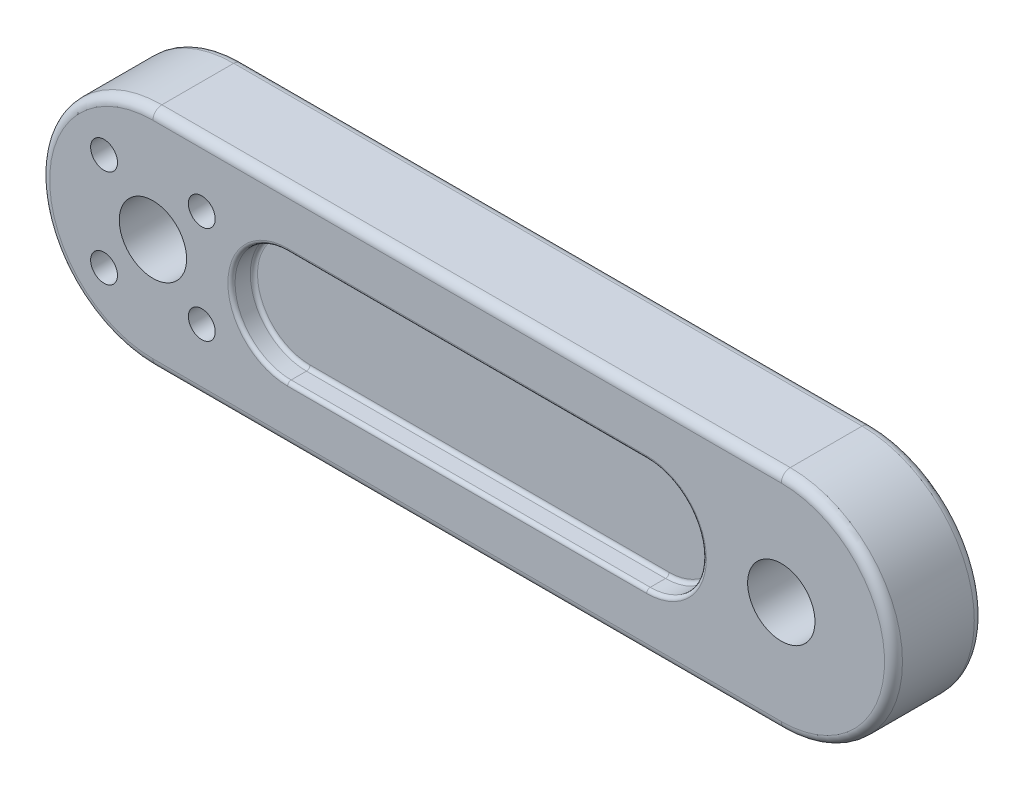
from build123d import *

# Parameters (mm, degrees)
SKETCH1_R           = 4.7625
BOSS_EXTRUDE1_DEPTH = 12.7
CUT_EXTRUDE2_DEPTH  = 12.7
FILLET1_R           = 1.27
CUT_EXTRUDE3_DEPTH  = 3.175
CUT_EXTRUDE4_START  = -3.175
CUT_EXTRUDE4_DEPTH  = 3.175
FILLET2_R           = 0.508


with BuildPart() as part:
    # Sketch1 → Boss-Extrude1 (new body)
    with BuildSketch(Plane.XY):
        with BuildLine():
            Line((-60.265453167, 23.365622701), (28.634546833, 23.365622701))
            ThreePointArc((28.634546833, 23.365622701), (44.509546833, 7.490622701), (28.634546833, -8.384377299))
            Line((28.634546833, -8.384377299), (-60.265453167, -8.384377299))
            ThreePointArc((-60.265453167, -8.384377299), (-76.140453167, 7.490622701), (-60.265453167, 23.365622701))
        make_face()
        with Locations((-60.265453167, 7.490622701)):
            Circle(SKETCH1_R, mode=Mode.SUBTRACT)
        with Locations((28.634546833, 7.490622701)):
            Circle(SKETCH1_R, mode=Mode.SUBTRACT)
    extrude(amount=BOSS_EXTRUDE1_DEPTH)

    # Sketch3 → Cut-Extrude2 (cut)
    with BuildSketch(Plane(origin=(0, 0, 0), x_dir=(-1, 0, 0), z_dir=(0, 0, -1))):
        with BuildLine():
            ThreePointArc((55.249305954, 14.405419915), (52.008107664, 15.747968205), (53.350655954, 12.506769915))
            Line((53.350655954, 12.506769915), (53.350655954, 14.405419915))
            Line((53.350655954, 14.405419915), (55.249305954, 14.405419915))
        make_face()
        with BuildLine():
            Line((53.350655954, 14.405419915), (53.350655954, 12.506769915))
            ThreePointArc((53.350655954, 12.506769915), (54.693204244, 13.062871624), (55.249305954, 14.405419915))
            Line((55.249305954, 14.405419915), (53.350655954, 14.405419915))
        make_face()
        with BuildLine():
            ThreePointArc((53.350655954, 2.474475488), (52.008107664, -0.766722802), (55.249305954, 0.575825488))
            Line((55.249305954, 0.575825488), (53.350655954, 0.575825488))
            Line((53.350655954, 0.575825488), (53.350655954, 2.474475488))
        make_face()
        with BuildLine():
            Line((53.350655954, 0.575825488), (55.249305954, 0.575825488))
            ThreePointArc((55.249305954, 0.575825488), (54.693204244, 1.918373778), (53.350655954, 2.474475488))
            Line((53.350655954, 2.474475488), (53.350655954, 0.575825488))
        make_face()
        with BuildLine():
            ThreePointArc((67.18025038, 2.474475488), (65.83770209, 1.918373778), (65.28160038, 0.575825488))
            Line((65.28160038, 0.575825488), (67.18025038, 0.575825488))
            Line((67.18025038, 0.575825488), (67.18025038, 2.474475488))
        make_face()
        with BuildLine():
            Line((67.18025038, 0.575825488), (65.28160038, 0.575825488))
            ThreePointArc((65.28160038, 0.575825488), (67.18025038, -1.322824512), (69.07890038, 0.575825488))
            ThreePointArc((69.07890038, 0.575825488), (68.52279867, 1.918373778), (67.18025038, 2.474475488))
            Line((67.18025038, 2.474475488), (67.18025038, 0.575825488))
        make_face()
        with BuildLine():
            ThreePointArc((65.28160038, 14.405419915), (65.83770209, 13.062871624), (67.18025038, 12.506769915))
            Line((67.18025038, 12.506769915), (67.18025038, 14.405419915))
            Line((67.18025038, 14.405419915), (65.28160038, 14.405419915))
        make_face()
        with BuildLine():
            Line((67.18025038, 14.405419915), (67.18025038, 12.506769915))
            ThreePointArc((67.18025038, 12.506769915), (68.52279867, 13.062871624), (69.07890038, 14.405419915))
            ThreePointArc((69.07890038, 14.405419915), (67.18025038, 16.304069915), (65.28160038, 14.405419915))
            Line((65.28160038, 14.405419915), (67.18025038, 14.405419915))
        make_face()
    extrude(amount=-CUT_EXTRUDE2_DEPTH, mode=Mode.SUBTRACT)

    # Fillet1
    fillet1_edges = [part.edges().sort_by_distance(p)[0] for p in [
        (44.509546833, 7.490622701, 12.7),
        (-15.815453167, 23.365622701, 12.7),
        (-76.140453167, 7.490622701, 12.7),
        (-15.815453167, 23.365622701, 0),
        (44.509546833, 7.490622701, 0),
        (-15.815453167, -8.384377299, 0),
        (-76.140453167, 7.490622701, 0),
        (-15.815453167, -8.384377299, 12.7),
    ]]
    fillet(fillet1_edges, radius=FILLET1_R)

    # Sketch4 → Cut-Extrude3 (cut)
    with BuildSketch(Plane(origin=(0, 0, 0), x_dir=(-1, 0, 0), z_dir=(0, 0, -1))):
        with BuildLine():
            Line((41.215453167, -0.446877299), (-9.584546833, -0.446877299))
            ThreePointArc((-9.584546833, -0.446877299), (-17.522046833, 7.490622701), (-9.584546833, 15.428122701))
            Line((-9.584546833, 15.428122701), (41.215453167, 15.428122701))
            ThreePointArc((41.215453167, 15.428122701), (49.152953167, 7.490622701), (41.215453167, -0.446877299))
        make_face()
    extrude(amount=-CUT_EXTRUDE3_DEPTH, mode=Mode.SUBTRACT)

    # Sketch5 → Cut-Extrude4 (cut)
    with BuildSketch(Plane.XY.offset(12.7).offset(CUT_EXTRUDE4_START)):
        with BuildLine():
            Line((-41.215453167, 15.428122701), (9.584546833, 15.428122701))
            ThreePointArc((9.584546833, 15.428122701), (17.522046833, 7.490622701), (9.584546833, -0.446877299))
            Line((9.584546833, -0.446877299), (-41.215453167, -0.446877299))
            ThreePointArc((-41.215453167, -0.446877299), (-49.152953167, 7.490622701), (-41.215453167, 15.428122701))
        make_face()
    extrude(amount=CUT_EXTRUDE4_DEPTH, mode=Mode.SUBTRACT)

    # Fillet2
    fillet2_edges = [part.edges().sort_by_distance(p)[0] for p in [
        (-49.152953167, 7.490622701, 3.175),
        (-15.815453167, -0.446877299, 3.175),
        (17.522046833, 7.490622701, 3.175),
        (-15.815453167, 15.428122701, 3.175),
        (-49.152953167, 7.490622701, 0),
        (-15.815453167, 15.428122701, 0),
        (17.522046833, 7.490622701, 0),
        (-15.815453167, -0.446877299, 0),
        (-49.152953167, 7.490622701, 9.525),
        (-15.815453167, 15.428122701, 9.525),
        (17.522046833, 7.490622701, 9.525),
        (-15.815453167, -0.446877299, 9.525),
        (-49.152953167, 7.490622701, 12.7),
        (-15.815453167, -0.446877299, 12.7),
        (17.522046833, 7.490622701, 12.7),
        (-15.815453167, 15.428122701, 12.7),
    ]]
    fillet(fillet2_edges, radius=FILLET2_R)


solid = part.part
